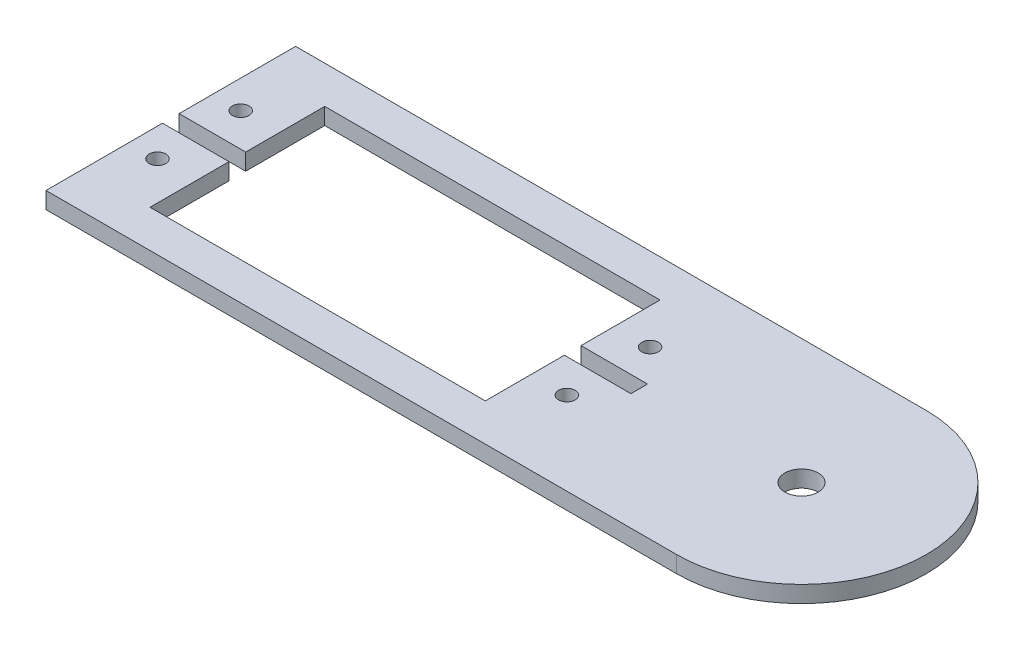
from build123d import *

# Parameters (mm, degrees)
SKETCH_1_R      = 1
SKETCH_1_R_2    = 2
EXTRUDE_1_DEPTH = 2


with BuildPart() as part:
    # Эскиз1 → Бобышка-Вытянуть1 (new body)
    with BuildSketch(Plane(origin=(0, 0, 0), x_dir=(1, 0, 0), z_dir=(0, 1, 0))):
        with BuildLine():
            Line((8, 25.5), (48.3, 25.5))
            Line((48.3, 25.5), (48.3, 16))
            Line((48.3, 16), (56.3, 16))
            Line((56.3, 16), (56.3, 14))
            Line((56.3, 14), (48.3, 14))
            Line((48.3, 14), (48.3, 4.5))
            Line((48.3, 4.5), (8, 4.5))
            Line((8, 4.5), (8, 14))
            Line((8, 14), (0, 14))
            Line((0, 14), (0, 0))
            Line((0, 0), (75.8, 0))
            ThreePointArc((75.8, 0), (90.8, 15), (75.8, 30))
            Line((75.8, 30), (0, 30))
            Line((0, 30), (0, 16))
            Line((0, 16), (8, 16))
            Line((8, 16), (8, 25.5))
        make_face()
        with Locations(Location((3.4, 10, 0), (0, 0, 270))):
            Circle(SKETCH_1_R, mode=Mode.SUBTRACT)
        with Locations(Location((3.4, 20, 0), (0, 0, 270))):
            Circle(SKETCH_1_R, mode=Mode.SUBTRACT)
        with Locations(Location((52.6, 10, 0), (0, 0, 270))):
            Circle(SKETCH_1_R, mode=Mode.SUBTRACT)
        with Locations(Location((52.6, 20, 0), (0, 0, 270))):
            Circle(SKETCH_1_R, mode=Mode.SUBTRACT)
        with Locations(Location((75.8, 15, 0), (0, 0, 270))):
            Circle(SKETCH_1_R_2, mode=Mode.SUBTRACT)
    extrude(amount=EXTRUDE_1_DEPTH)


solid = part.part
